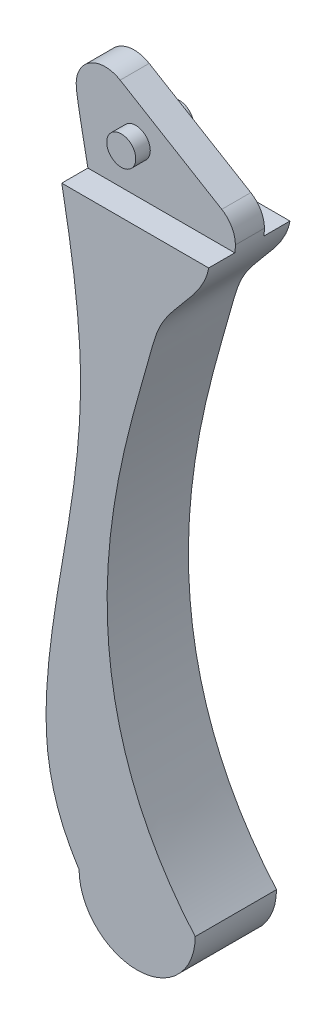
from build123d import *

# Parameters (mm, degrees)
BOSS_EXTRUDE1_DEPTH = 28
SKETCH4_W           = 20
SKETCH4_H           = 28
REVOLVE2_ANGLE      = 180
SKETCH8_W           = 9
SKETCH8_H           = 33.21296959
CUT_EXTRUDE1_DEPTH  = 45
SKETCH9_R           = 5
BOSS_EXTRUDE2_DEPTH = 5


with BuildPart() as part:
    # Sketch1 → Boss-Extrude1 (new body)
    with BuildSketch(Plane.XY):
        with BuildLine():
            Line((0, -225), (40, -225))
            add(Edge.make_bspline(
                [(44.837749122, -20.758189433), (44.837749122, -31.369390936), (28.889425137, -41.782899382), (19.026841833, -81.321540561), (-10.380022908, -166.862499306), (40, -225)],
                knots=[0, 0, 0, 0, 0.243335168, 0.343335168, 1, 1, 1, 1], degree=3))
            ThreePointArc((44.837749122, -20.758189433), (43.585451091, -16.000112379), (40.153070139, -12.475015414))
            Line((40.153070139, -12.475015414), (5.153070139, 8.570056484))
            ThreePointArc((5.153070139, 8.570056484), (-4.922870027, 8.704329423), (-10, 0))
            add(Edge.make_bspline(
                [(-10, 0), (-10, -6.033622411), (-1.935159008, -36.567795894), (2.930618137, -106.909125291), (-14.496902926, -160.944662091), (-10.77837774, -208.408825579), (0, -225)],
                knots=[0, 0, 0, 0, 0.308474866, 0.388557837, 0.800829708, 1, 1, 1, 1], degree=3))
        make_face()
    extrude(amount=BOSS_EXTRUDE1_DEPTH)

    # Sketch4 → Revolve2 (revolve)
    with BuildSketch(Plane.XZ.offset(225)):
        with Locations((30, 14)):
            Rectangle(SKETCH4_W, SKETCH4_H)
    revolve(axis=Axis((20, -225, 28), (0, 0, -1)), revolution_arc=REVOLVE2_ANGLE)

    # Sketch8 → Cut-Extrude1 (cut, symmetric)
    with BuildSketch(Plane(origin=(0, 0, 0), x_dir=(0, 0, -1), z_dir=(1, 0, 0))):
        with Locations((-23.5, -6.606484795)):
            Rectangle(SKETCH8_W, SKETCH8_H)
    cut_extrude1 = extrude(amount=CUT_EXTRUDE1_DEPTH, both=True, mode=Mode.SUBTRACT)

    # Mirror1: Cut-Extrude1 across plane
    add(cut_extrude1.mirror(Plane.XY.offset(14)), mode=Mode.SUBTRACT)

    # Sketch9 → Boss-Extrude2 (add)
    with BuildSketch(Plane.XY.offset(19)):
        with Locations((10.525146493, -7.245327121)):
            Circle(SKETCH9_R)
    boss_extrude2 = extrude(amount=BOSS_EXTRUDE2_DEPTH)

    # Mirror2: Boss-Extrude2 across plane
    add(boss_extrude2.mirror(Plane.XY.offset(14)))


solid = part.part
